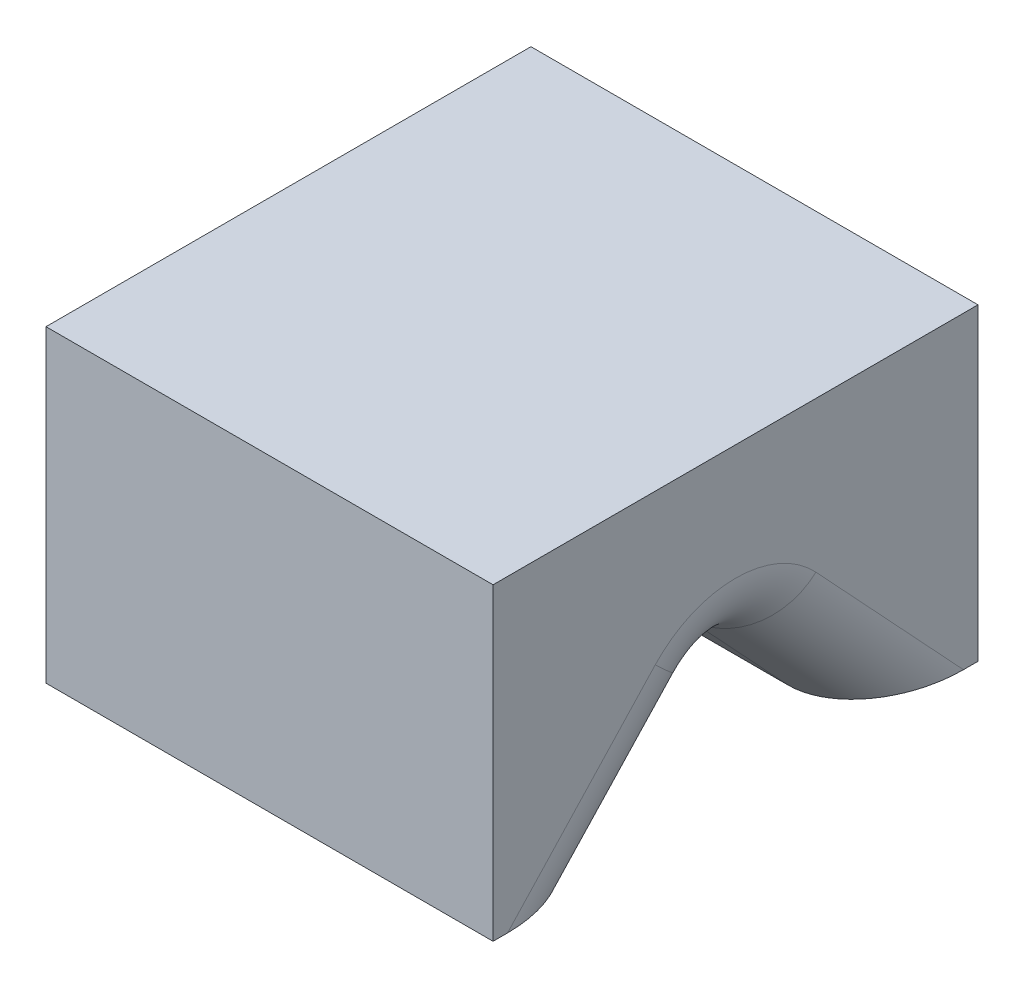
from build123d import *

# Parameters (mm, degrees)
SKETCH_TL_CUTTING_R    = 1.4986
TL_CUTTING_DEPTH       = 29.999999944
SKETCH_TDF_CUTTING_W   = 3.01719996
SKETCH_TDF_CUTTING_H   = 3.01719996
TDF_CUTTING_DEPTH      = 31.074766841
VW_VR_GRINDING_DEPTH   = 1.50859998
VW_VR_GRINDING_2_DEPTH = 1.50859998
ISA_GRINDING_DEPTH     = 1.50859998
SKETCH_PRE_FRX_BRX_W   = 1.19142002
SKETCH_PRE_FRX_BRX_H   = 0.89916
SKETCH_PRE_FRX_BRX_W_2 = 1.21633996
PRE_FRX_BRX_DEPTH      = 1.50859998
FA_BA_GRINDING_DEPTH   = 1.50859998
BR_EDM_R               = 0.09906
FR_EDM_R               = 0.0508


with BuildPart() as part:
    # sketch_TL_cutting → TL_cutting (new body)
    with BuildSketch(Plane(origin=(0, 0, 0), x_dir=(1, 0, 0), z_dir=(0, 1, 0))):
        with Locations(Location((0, 0, 0), (0, 0, 270))):
            Circle(SKETCH_TL_CUTTING_R)
    extrude(amount=TL_CUTTING_DEPTH)

    # sketch_TDF_cutting → TDF_cutting (cut, through all)
    with BuildSketch(Plane(origin=(0, 0, 0), x_dir=(1, 0, 0), z_dir=(0, 1, 0))):
        with Locations((-2.71001998, 0)):
            Rectangle(SKETCH_TDF_CUTTING_W, SKETCH_TDF_CUTTING_H)
    extrude(amount=TDF_CUTTING_DEPTH, mode=Mode.SUBTRACT)


with BuildPart() as body_2:
    # sketch_VW_VR_grinding → VW_VR_grinding (new, symmetric)
    with BuildSketch(Plane(origin=(0, 0, 0), x_dir=(0, 0, -1), z_dir=(1, 0, 0))):
        with BuildLine():
            Line((-0.32512, -0.00999998), (-0.32512, 0.707757271))
            ThreePointArc((-0.32512, 0.707757271), (-0.37626658, 0.860618287), (-0.509108112, 0.951917742))
            Line((-0.509108112, 0.951917742), (-1.51859996, 1.241384872))
            Line((-1.51859996, 1.241384872), (-1.50859998, -0.00999998))
            Line((-1.50859998, -0.00999998), (-0.32512, -0.00999998))
        make_face()
    extrude(amount=VW_VR_GRINDING_DEPTH, both=True)


with BuildPart() as body_3:
    # sketch_VW_VR_grinding → VW_VR_grinding 2 (new, symmetric)
    with BuildSketch(Plane(origin=(0, 0, 0), x_dir=(0, 0, -1), z_dir=(1, 0, 0))):
        with BuildLine():
            Line((0.32512, -0.00999998), (0.32512, 0.707757271))
            ThreePointArc((0.32512, 0.707757271), (0.37626658, 0.860618287), (0.509108112, 0.951917742))
            Line((0.509108112, 0.951917742), (1.51859996, 1.241384872))
            Line((1.51859996, 1.241384872), (1.50859998, -0.00999998))
            Line((1.50859998, -0.00999998), (0.32512, -0.00999998))
        make_face()
    extrude(amount=VW_VR_GRINDING_2_DEPTH, both=True)


    add(body_2.part)  # ISA_grinding merges body 2
    # sketch_ISA_grinding → ISA_grinding (add, symmetric)
    with BuildSketch(Plane(origin=(0, 0, 0), x_dir=(0, 0, -1), z_dir=(1, 0, 0))):
        Polygon((-0.32512, 0), (0.32512, 0), (1.50859998, 6.711848494), (1.50859998, -0.02999994), (-1.50859998, -0.02999994), (-1.50859998, 6.711848494), align=None)
    extrude(amount=ISA_GRINDING_DEPTH, both=True)

    # sketch_pre_FRX_BRX → pre_FRX_BRX (add, symmetric)
    with BuildSketch(Plane.XY):
        with Locations((0.90288999, 0.43958002)):
            Rectangle(SKETCH_PRE_FRX_BRX_W, SKETCH_PRE_FRX_BRX_H)
        with Locations((-0.91042998, 0.43958002)):
            Rectangle(SKETCH_PRE_FRX_BRX_W_2, SKETCH_PRE_FRX_BRX_H)
    extrude(amount=PRE_FRX_BRX_DEPTH, both=True)

    # sketch_FA_BA_grinding → FA_BA_grinding (add, symmetric)
    with BuildSketch(Plane.XY):
        Polygon((0.29718, -0.00999998), (0.29718, 0.89916), (1.6256, 10.351359447), (1.6256, -0.00999998), align=None)
        Polygon((-0.30226, -0.00999998), (-0.30226, 0.89916), (-1.32842, 8.200667794), (-1.32842, -0.00999998), align=None)
    extrude(amount=FA_BA_GRINDING_DEPTH, both=True)


with BuildPart() as part_1:
    add(part.part)

    # B1_fix: cut body 3
    add(body_3.part, mode=Mode.SUBTRACT)

    # V-Groove_EDM: sweep along a path in sketch_contour_V-Groove
    with BuildLine(Plane.XY) as v_groove_edm_path:
        Line((-1.20142, 0.16002), (1.4986, 0.16002))
    # sketch_section_V-Groove → V-Groove_EDM (sweep, cut)
    with BuildSketch(Plane(origin=(-1.20142, 0, -1.2954), x_dir=(0, 0, -1), z_dir=(1, 0, 0))):
        with BuildLine():
            Line((-1.26010487, 0.144673241), (-1.115869758, -0.00999998))
            Line((-1.115869758, -0.00999998), (-1.474930242, -0.00999998))
            Line((-1.474930242, -0.00999998), (-1.33069513, 0.144673241))
            ThreePointArc((-1.33069513, 0.144673241), (-1.2954, 0.16002), (-1.26010487, 0.144673241))
        make_face()
    sweep(path=v_groove_edm_path.line, mode=Mode.SUBTRACT)

    # BR_EDM
    br_edm_edges = [part_1.edges().sort_by_distance(p)[0] for p in [
        (0.29718, 0.07233662, -0.102750119),
        (0.29718, 0.16002, 0),
        (0.29718, 0.07233662, 0.102750119),
    ]]
    fillet(br_edm_edges, radius=BR_EDM_R)

    # FR_EDM
    fr_edm_edges = [part_1.edges().sort_by_distance(p)[0] for p in [
        (-0.30226, 0.16002, 0),
        (-0.30226, 0.07233662, -0.102750119),
        (-0.30226, 0.07233662, 0.102750119),
    ]]
    fillet(fr_edm_edges, radius=FR_EDM_R)

    # SurfaceCut1
    split(bisect_by=Plane(origin=(0, 0.41401793, 0), x_dir=(1, 0, 0), z_dir=(0, 1, 0)), keep=Keep.BOTTOM)


solid = part_1.part
